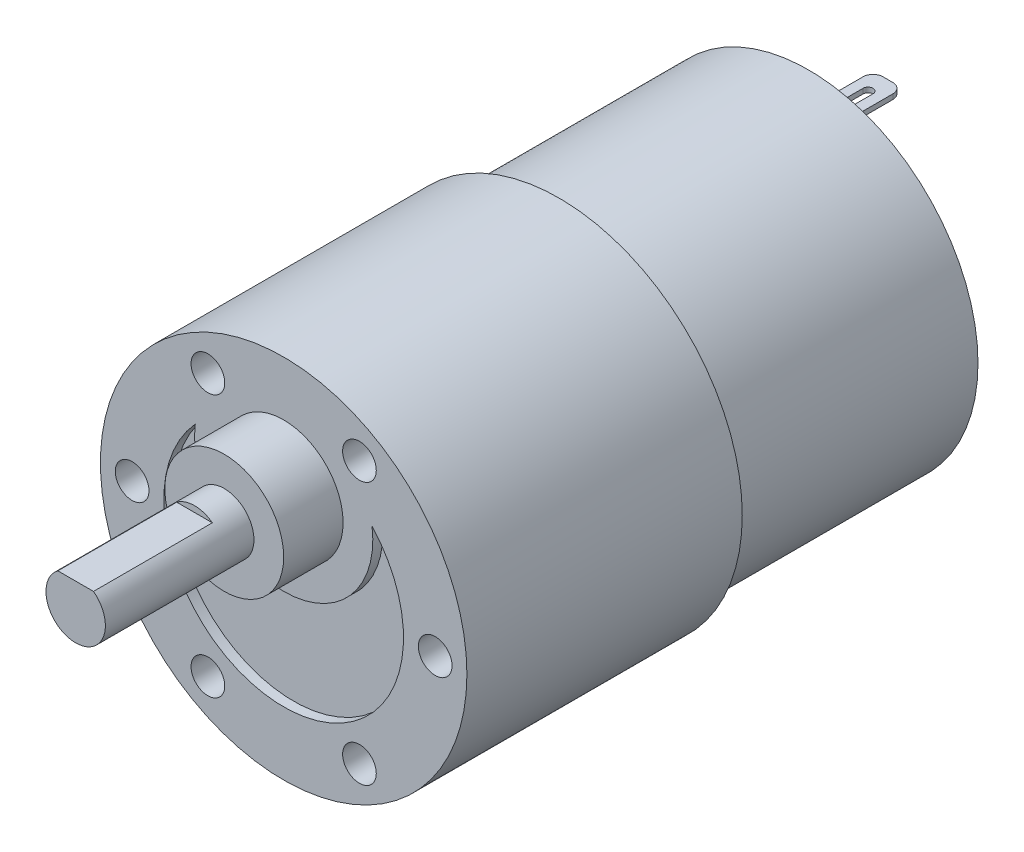
from build123d import *

# Parameters (mm, degrees)
SKETCH1_R                = 18.5
BOSS_EXTRUDE1_DEPTH      = 27.8
SKETCH2_R                = 17.1
BOSS_EXTRUDE2_DEPTH      = 25.2
SKETCH3_R                = 3.75
BOSS_EXTRUDE3_DEPTH      = 3.3
SKETCH4_R                = 6
BOSS_EXTRUDE4_DEPTH      = 6
SKETCH5_R                = 3
BOSS_EXTRUDE6_DEPTH      = 15
CUT_EXTRUDE1_START       = -12
CUT_EXTRUDE1_DEPTH       = 12
CUT_EXTRUDE2_DEPTH       = 1
M3_CLEARANCE_HOLE1_D     = 3.4
M3_CLEARANCE_HOLE1_DEPTH = 6
M3_CLEARANCE_HOLE1_TIP   = 1.021463052
SKETCH11_W               = 3
SKETCH11_H               = 0.5
BOSS_EXTRUDE7_DEPTH      = 8
FILLET1_R                = 1
CUT_EXTRUDE3_DEPTH       = 28


with BuildPart() as part:
    # Sketch1 → Boss-Extrude1 (new body)
    with BuildSketch(Plane.XY):
        Circle(SKETCH1_R)
    extrude(amount=BOSS_EXTRUDE1_DEPTH)

    # Sketch2 → Boss-Extrude2 (add)
    with BuildSketch(Plane(origin=(0, 0, 0), x_dir=(-1, 0, 0), z_dir=(0, 0, -1))):
        with Locations(Location((0, 0, 0), (0, 0, 180))):
            Circle(SKETCH2_R)
    extrude(amount=BOSS_EXTRUDE2_DEPTH)

    # Sketch3 → Boss-Extrude3 (add)
    with BuildSketch(Plane(origin=(0, 0, -25.2), x_dir=(-1, 0, 0), z_dir=(0, 0, -1))):
        Circle(SKETCH3_R)
    extrude(amount=BOSS_EXTRUDE3_DEPTH)

    # Sketch4 → Boss-Extrude4 (add)
    with BuildSketch(Plane.XY.offset(27.8)):
        with Locations((0, 7)):
            Circle(SKETCH4_R)
    extrude(amount=BOSS_EXTRUDE4_DEPTH)

    # Sketch5 → Boss-Extrude6 (add)
    with BuildSketch(Plane.XY.offset(33.8)):
        with Locations((0, 7)):
            Circle(SKETCH5_R)
    extrude(amount=BOSS_EXTRUDE6_DEPTH)

    # Sketch7 → Cut-Extrude1 (cut)
    with BuildSketch(Plane.XY.offset(48.8).offset(CUT_EXTRUDE1_START)):
        with BuildLine():
            Line((-1.8, 9.4), (1.8, 9.4))
            ThreePointArc((1.8, 9.4), (0, 10), (-1.8, 9.4))
        make_face()
    extrude(amount=CUT_EXTRUDE1_DEPTH, mode=Mode.SUBTRACT)

    # Sketch8 → Cut-Extrude2 (cut)
    with BuildSketch(Plane.XY.offset(27.8)):
        with BuildLine():
            ThreePointArc((8.923344727, 8.172142857), (0, -12.1), (-8.923344727, 8.172142857))
            ThreePointArc((-8.923344727, 8.172142857), (0, -2), (8.923344727, 8.172142857))
        make_face()
    extrude(amount=-CUT_EXTRUDE2_DEPTH, mode=Mode.SUBTRACT)

    # M3 Clearance Hole1
    with Locations(Plane.XY.offset(27.8)):
        with Locations((7.65, -13.250188678), (-7.65, -13.250188678), (-15.3, 0), (-7.65, 13.250188678), (15.3, 0), (7.65, 13.250188678)):
            Hole(M3_CLEARANCE_HOLE1_D / 2, depth=M3_CLEARANCE_HOLE1_DEPTH)
            with Locations((0, 0, -(M3_CLEARANCE_HOLE1_DEPTH + M3_CLEARANCE_HOLE1_TIP / 2))):  # 118° drill point
                Cone(0, M3_CLEARANCE_HOLE1_D / 2, M3_CLEARANCE_HOLE1_TIP, mode=Mode.SUBTRACT)

    # Sketch11 → Boss-Extrude7 (add)
    with BuildSketch(Plane(origin=(0, 0, -25.2), x_dir=(-1, 0, 0), z_dir=(0, 0, -1))):
        with Locations((0, 12)):
            Rectangle(SKETCH11_W, SKETCH11_H)
        with Locations((0, -12)):
            Rectangle(SKETCH11_W, SKETCH11_H)
    extrude(amount=BOSS_EXTRUDE7_DEPTH)

    # Fillet1
    fillet1_edges = [part.edges().sort_by_distance(p)[0] for p in [
        (-1.5, 12, -33.2),
        (1.5, 12, -33.2),
        (-1.5, -12, -33.2),
        (1.5, -12, -33.2),
    ]]
    fillet(fillet1_edges, radius=FILLET1_R)

    # Sketch12 → Cut-Extrude3 (cut)
    with BuildSketch(Plane(origin=(0, 12.25, 0), x_dir=(1, 0, 0), z_dir=(0, 1, 0))):
        with BuildLine():
            Line((0.492088327, 31.2), (0.492088327, 29.2))
            ThreePointArc((0.492088327, 29.2), (0, 28.707911673), (-0.492088327, 29.2))
            Line((-0.492088327, 29.2), (-0.492088327, 31.2))
            ThreePointArc((-0.492088327, 31.2), (0, 31.692088327), (0.492088327, 31.2))
        make_face()
    extrude(amount=-CUT_EXTRUDE3_DEPTH, mode=Mode.SUBTRACT)


solid = part.part
